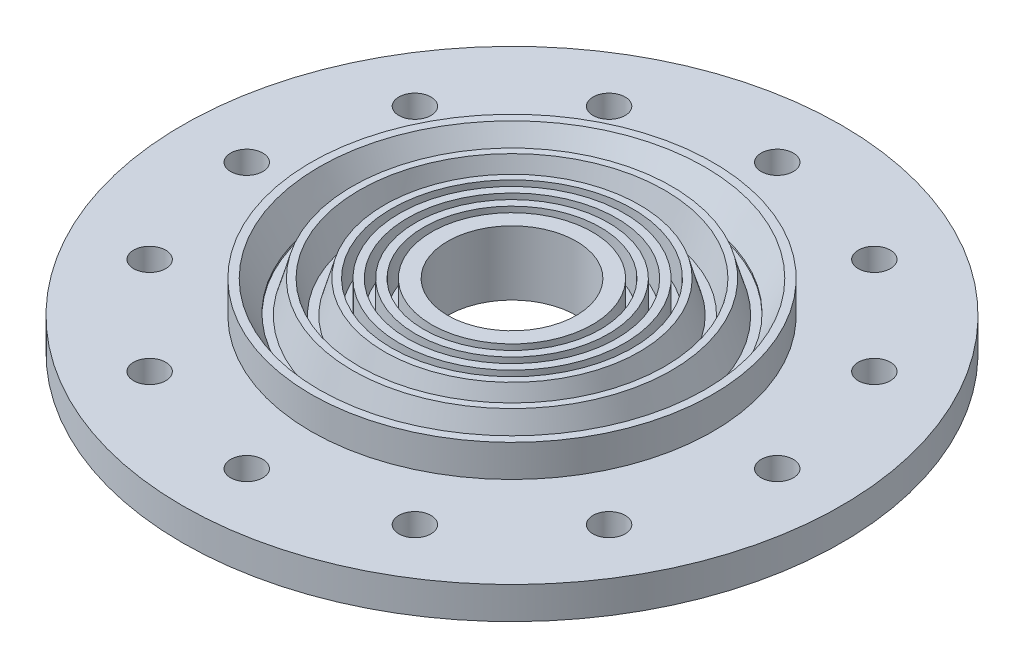
from build123d import *

# Parameters (mm, degrees)
SKETCH1_R             = 15.875
SKETCH1_R_2           = 12.7
BOSS_EXTRUDE2_DEPTH   = 12.7
SKETCH1_R_3           = 26.9875
SKETCH1_R_4           = 23.8125
BOSS_EXTRUDE2_2_DEPTH = 12.7
SKETCH1_R_5           = 33.3375
SKETCH1_R_6           = 28.575
BOSS_EXTRUDE2_3_DEPTH = 12.7
SKETCH1_R_7           = 39.6875
SKETCH1_R_8           = 34.925
BOSS_EXTRUDE2_4_DEPTH = 12.7
CHAMFER1_SIZE         = 3.175
CHAMFER1_SIZE2        = 5.971306527
CHAMFER2_SIZE         = 6.35
CHAMFER2_SIZE2        = 1.8208332
CHAMFER3_SIZE         = 1.5875
CHAMFER3_SIZE2        = 6.367114732
CHAMFER4_SIZE         = 6.35
CHAMFER4_SIZE2        = 1.8208332
SKETCH1_20_R          = 65.0875
SKETCH1_20_R_2        = 39.6875
SKETCH1_20_R_3        = 3.175
SKETCH1_20_R_4        = 34.925
SKETCH1_20_R_5        = 33.3375
SKETCH1_20_R_6        = 28.575
SKETCH1_20_R_7        = 26.9875
SKETCH1_20_R_8        = 23.8125
SKETCH1_20_R_9        = 22.225
SKETCH1_20_R_10       = 20.6375
SKETCH1_20_R_11       = 19.05
SKETCH1_20_R_12       = 17.4625
SKETCH1_20_R_13       = 15.875
BOSS_EXTRUDE3_DEPTH   = 6.35
SKETCH1_21_R          = 22.225
SKETCH1_21_R_2        = 20.6375
SKETCH1_21_R_3        = 19.05
SKETCH1_21_R_4        = 17.4625
BOSS_EXTRUDE4_DEPTH   = 12.7


with BuildPart() as part:
    # Sketch1 → Boss-Extrude2 (new body)
    with BuildSketch(Plane(origin=(0, 0, 0), x_dir=(1, 0, 0), z_dir=(0, 1, 0))):
        Circle(SKETCH1_R)
        Circle(SKETCH1_R_2, mode=Mode.SUBTRACT)
    extrude(amount=BOSS_EXTRUDE2_DEPTH)



with BuildPart() as body_2:
    # Sketch1 → Boss-Extrude2 2 (new body)
    with BuildSketch(Plane(origin=(0, 0, 0), x_dir=(1, 0, 0), z_dir=(0, 1, 0))):
        Circle(SKETCH1_R_3)
        Circle(SKETCH1_R_4, mode=Mode.SUBTRACT)
    extrude(amount=BOSS_EXTRUDE2_2_DEPTH)

    # Chamfer4
    chamfer4_edges = [body_2.edges().sort_by_distance(p)[0] for p in [
        (-26.9875, 12.7, 0),
    ]]
    chamfer4_side = [body_2.faces().sort_by_distance(p)[0] for p in [
        (-26.9875, 6.35, 0),
    ]]
    chamfer(chamfer4_edges, length=CHAMFER4_SIZE, length2=CHAMFER4_SIZE2, reference=chamfer4_side[0])


with BuildPart() as body_3:
    # Sketch1 → Boss-Extrude2 3 (new body)
    with BuildSketch(Plane(origin=(0, 0, 0), x_dir=(1, 0, 0), z_dir=(0, 1, 0))):
        Circle(SKETCH1_R_5)
        Circle(SKETCH1_R_6, mode=Mode.SUBTRACT)
    extrude(amount=BOSS_EXTRUDE2_3_DEPTH)

    # Chamfer2
    chamfer2_edges = [body_3.edges().sort_by_distance(p)[0] for p in [
        (-33.3375, 12.7, 0),
    ]]
    chamfer2_side = [body_3.faces().sort_by_distance(p)[0] for p in [
        (-33.3375, 6.35, 0),
    ]]
    chamfer(chamfer2_edges, length=CHAMFER2_SIZE, length2=CHAMFER2_SIZE2, reference=chamfer2_side[0])

    # Chamfer3
    chamfer3_edges = [body_3.edges().sort_by_distance(p)[0] for p in [
        (-28.575, 12.7, 0),
    ]]
    chamfer3_side = [body_3.faces().sort_by_distance(p)[0] for p in [
        (-30.625240848, 12.7, 0),
    ]]
    chamfer(chamfer3_edges, length=CHAMFER3_SIZE, length2=CHAMFER3_SIZE2, reference=chamfer3_side[0])


with BuildPart() as body_4:
    # Sketch1 → Boss-Extrude2 4 (new body)
    with BuildSketch(Plane(origin=(0, 0, 0), x_dir=(1, 0, 0), z_dir=(0, 1, 0))):
        Circle(SKETCH1_R_7)
        Circle(SKETCH1_R_8, mode=Mode.SUBTRACT)
    extrude(amount=BOSS_EXTRUDE2_4_DEPTH)

    # Chamfer1
    chamfer1_edges = [body_4.edges().sort_by_distance(p)[0] for p in [
        (-34.925, 12.7, 0),
    ]]
    chamfer1_side = [body_4.faces().sort_by_distance(p)[0] for p in [
        (-38.564967985, 12.7, 0),
    ]]
    chamfer(chamfer1_edges, length=CHAMFER1_SIZE, length2=CHAMFER1_SIZE2, reference=chamfer1_side[0])


with BuildPart() as part_1:
    add(part.part)

    add(body_2.part)  # Boss-Extrude3 merges body 2

    add(body_3.part)  # Boss-Extrude3 merges body 3

    add(body_4.part)  # Boss-Extrude3 merges body 4
    # Sketch1<20> → Boss-Extrude3 (add)
    # profile 1 of 6: a face of its own
    with BuildSketch(Plane(origin=(0, 0, 0), x_dir=(1, 0, 0), z_dir=(0, 1, 0))):
        Circle(SKETCH1_20_R)
        Circle(SKETCH1_20_R_2, mode=Mode.SUBTRACT)
        with Locations((-26.19375, -45.368905841)):
            Circle(SKETCH1_20_R_3, mode=Mode.SUBTRACT)
        with Locations((-45.368905841, -26.19375)):
            Circle(SKETCH1_20_R_3, mode=Mode.SUBTRACT)
        with Locations((-52.3875, 0)):
            Circle(SKETCH1_20_R_3, mode=Mode.SUBTRACT)
        with Locations((0, -52.3875)):
            Circle(SKETCH1_20_R_3, mode=Mode.SUBTRACT)
        with Locations((26.19375, -45.368905841)):
            Circle(SKETCH1_20_R_3, mode=Mode.SUBTRACT)
        with Locations((45.368905841, -26.19375)):
            Circle(SKETCH1_20_R_3, mode=Mode.SUBTRACT)
        with Locations((-45.368905841, 26.19375)):
            Circle(SKETCH1_20_R_3, mode=Mode.SUBTRACT)
        with Locations((-26.19375, 45.368905841)):
            Circle(SKETCH1_20_R_3, mode=Mode.SUBTRACT)
        with Locations((0, 52.3875)):
            Circle(SKETCH1_20_R_3, mode=Mode.SUBTRACT)
        with Locations((45.368905841, 26.19375)):
            Circle(SKETCH1_20_R_3, mode=Mode.SUBTRACT)
        with Locations((26.19375, 45.368905841)):
            Circle(SKETCH1_20_R_3, mode=Mode.SUBTRACT)
        with Locations((52.3875, 0)):
            Circle(SKETCH1_20_R_3, mode=Mode.SUBTRACT)
    # profile 2 of 6: a face of its own
    with BuildSketch(Plane(origin=(0, 0, 0), x_dir=(1, 0, 0), z_dir=(0, 1, 0))):
        Circle(SKETCH1_20_R_4)
        Circle(SKETCH1_20_R_5, mode=Mode.SUBTRACT)
    # profile 3 of 6: a face of its own
    with BuildSketch(Plane(origin=(0, 0, 0), x_dir=(1, 0, 0), z_dir=(0, 1, 0))):
        Circle(SKETCH1_20_R_6)
        Circle(SKETCH1_20_R_7, mode=Mode.SUBTRACT)
    # profile 4 of 6: a face of its own
    with BuildSketch(Plane(origin=(0, 0, 0), x_dir=(1, 0, 0), z_dir=(0, 1, 0))):
        Circle(SKETCH1_20_R_8)
        Circle(SKETCH1_20_R_9, mode=Mode.SUBTRACT)
    # profile 5 of 6: a face of its own
    with BuildSketch(Plane(origin=(0, 0, 0), x_dir=(1, 0, 0), z_dir=(0, 1, 0))):
        Circle(SKETCH1_20_R_10)
        Circle(SKETCH1_20_R_11, mode=Mode.SUBTRACT)
    # profile 6 of 6: a face of its own
    with BuildSketch(Plane(origin=(0, 0, 0), x_dir=(1, 0, 0), z_dir=(0, 1, 0))):
        Circle(SKETCH1_20_R_12)
        Circle(SKETCH1_20_R_13, mode=Mode.SUBTRACT)
    extrude(amount=BOSS_EXTRUDE3_DEPTH)

    # Sketch1<21> → Boss-Extrude4 (add)
    # profile 1 of 2: a face of its own
    with BuildSketch(Plane(origin=(0, 0, 0), x_dir=(1, 0, 0), z_dir=(0, 1, 0))):
        Circle(SKETCH1_21_R)
        Circle(SKETCH1_21_R_2, mode=Mode.SUBTRACT)
    # profile 2 of 2: a face of its own
    with BuildSketch(Plane(origin=(0, 0, 0), x_dir=(1, 0, 0), z_dir=(0, 1, 0))):
        Circle(SKETCH1_21_R_3)
        Circle(SKETCH1_21_R_4, mode=Mode.SUBTRACT)
    extrude(amount=BOSS_EXTRUDE4_DEPTH)


solid = part_1.part
